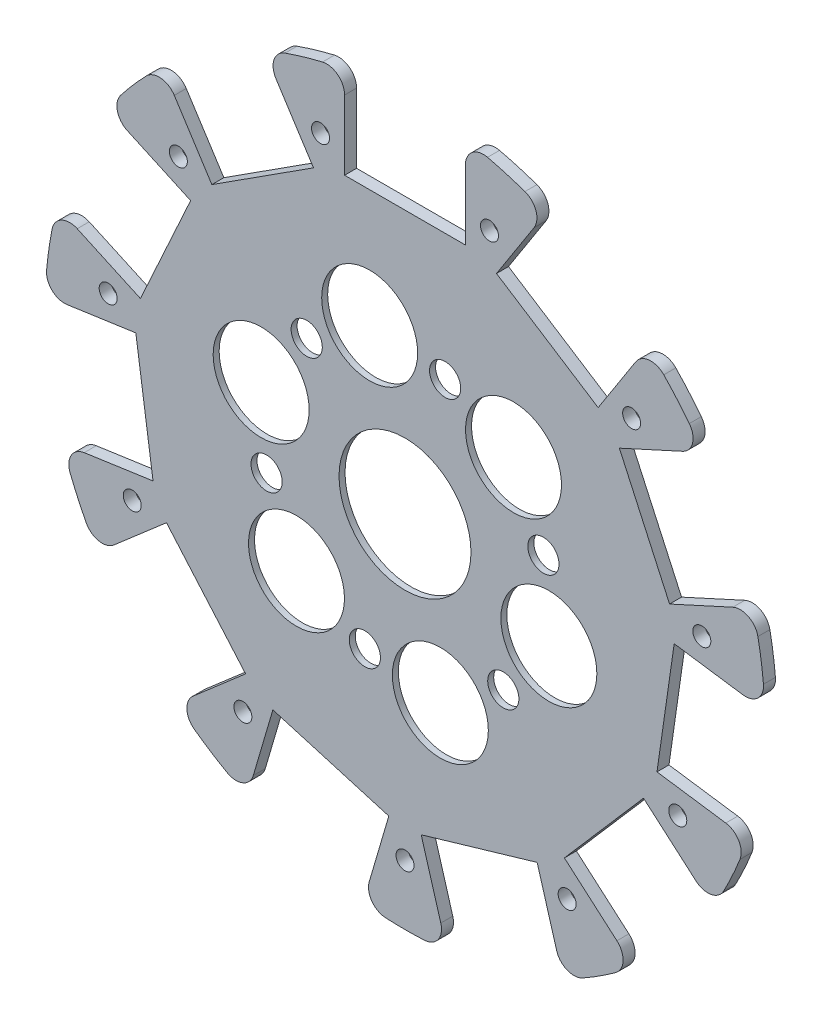
from build123d import *

# Parameters (mm, degrees)
BOSS_EXTRUDE1_DEPTH = 2
SKETCH4_R           = 1.5
CUT_EXTRUDE3_DEPTH  = 2
SKETCH6_R           = 35
CUT_EXTRUDE4_DEPTH  = 1
SKETCH7_R           = 11
SKETCH7_R_2         = 2.6
SKETCH7_R_3         = 8
CUT_EXTRUDE5_DEPTH  = 10


with BuildPart() as part:
    # Sketch1 → Boss-Extrude1 (new body)
    with BuildSketch(Plane.XY):
        with BuildLine():
            Line((21.520746486, 52.119258472), (15.256667967, 42.372162038))
            Line((15.256667967, 42.372162038), (32.20522538, 31.479985569))
            Line((32.20522538, 31.479985569), (38.4693039, 41.227082003))
            ThreePointArc((38.4693039, 41.227082003), (40.698070229, 42.590620718), (43.150594208, 41.689641633))
            ThreePointArc((43.150594208, 41.689641633), (45.344974461, 39.291644037), (47.406271028, 36.778328771))
            ThreePointArc((47.406271028, 36.778328771), (47.949048893, 34.222545257), (46.282202516, 32.210516346))
            Line((46.282202516, 32.210516346), (35.742846148, 27.397353567))
            Line((35.742846148, 27.397353567), (44.112124759, 9.071189697))
            Line((44.112124759, 9.071189697), (54.651481127, 13.884352476))
            ThreePointArc((54.651481127, 13.884352476), (57.263623361, 13.826472187), (58.839711753, 11.742585779))
            ThreePointArc((58.839711753, 11.742585779), (59.389286513, 8.538890296), (59.764558712, 5.310133889))
            ThreePointArc((59.764558712, 5.310133889), (58.83941162, 2.86662411), (56.349386262, 2.075162869))
            Line((56.349386262, 2.075162869), (44.880923224, 3.724078919))
            Line((44.880923224, 3.724078919), (42.013736207, -16.217644809))
            Line((42.013736207, -16.217644809), (53.482199245, -17.86656086))
            ThreePointArc((53.482199245, -17.86656086), (55.648380681, -19.32748357), (55.847636558, -21.93265809))
            ThreePointArc((55.847636558, -21.93265809), (54.577919721, -24.92490078), (53.148021281, -27.843990983))
            ThreePointArc((53.148021281, -27.843990983), (51.048676897, -29.399429937), (48.526038015, -28.719040157))
            Line((48.526038015, -28.719040157), (39.76962429, -21.131564473))
            Line((39.76962429, -21.131564473), (26.576283265, -36.357491677))
            Line((26.576283265, -36.357491677), (35.33269699, -43.944967362))
            ThreePointArc((35.33269699, -43.944967362), (36.365170327, -46.345099856), (35.124331356, -48.644437984))
            ThreePointArc((35.124331356, -48.644437984), (32.438449047, -50.47521197), (29.657362619, -52.157845455))
            ThreePointArc((29.657362619, -52.157845455), (27.050347952, -52.331372705), (25.296015568, -50.395150852))
            Line((25.296015568, -50.395150852), (22.031750643, -39.278085453))
            Line((22.031750643, -39.278085453), (2.701048165, -44.954091828))
            Line((2.701048165, -44.954091828), (5.96531309, -56.071157227))
            ThreePointArc((5.96531309, -56.071157227), (5.536275339, -58.648474396), (3.249299125, -59.911952524))
            ThreePointArc((3.249299125, -59.911952524), (0, -60), (-3.249299125, -59.911952524))
            ThreePointArc((-3.249299125, -59.911952524), (-5.536275339, -58.648474396), (-5.96531309, -56.071157227))
            Line((-5.96531309, -56.071157227), (-2.701048165, -44.954091828))
            Line((-2.701048165, -44.954091828), (-22.031750643, -39.278085453))
            Line((-22.031750643, -39.278085453), (-25.296015568, -50.395150852))
            ThreePointArc((-25.296015568, -50.395150852), (-27.050347952, -52.331372705), (-29.657362619, -52.157845455))
            ThreePointArc((-29.657362619, -52.157845455), (-32.438449047, -50.47521197), (-35.124331356, -48.644437984))
            ThreePointArc((-35.124331356, -48.644437984), (-36.365170327, -46.345099856), (-35.33269699, -43.944967362))
            Line((-35.33269699, -43.944967362), (-26.576283265, -36.357491677))
            Line((-26.576283265, -36.357491677), (-39.76962429, -21.131564473))
            Line((-39.76962429, -21.131564473), (-48.526038015, -28.719040157))
            ThreePointArc((-48.526038015, -28.719040157), (-51.048676897, -29.399429937), (-53.148021281, -27.843990983))
            ThreePointArc((-53.148021281, -27.843990983), (-54.577919721, -24.92490078), (-55.847636558, -21.93265809))
            ThreePointArc((-55.847636558, -21.93265809), (-55.648380681, -19.32748357), (-53.482199245, -17.86656086))
            Line((-53.482199245, -17.86656086), (-42.013736207, -16.217644809))
            Line((-42.013736207, -16.217644809), (-44.880923224, 3.724078919))
            Line((-44.880923224, 3.724078919), (-56.349386262, 2.075162869))
            ThreePointArc((-56.349386262, 2.075162869), (-58.83941162, 2.86662411), (-59.764558712, 5.310133889))
            ThreePointArc((-59.764558712, 5.310133889), (-59.389286513, 8.538890296), (-58.839711753, 11.742585779))
            ThreePointArc((-58.839711753, 11.742585779), (-57.263623361, 13.826472187), (-54.651481127, 13.884352476))
            Line((-54.651481127, 13.884352476), (-44.112124759, 9.071189697))
            Line((-44.112124759, 9.071189697), (-35.742846148, 27.397353567))
            Line((-35.742846148, 27.397353567), (-46.282202516, 32.210516346))
            ThreePointArc((-46.282202516, 32.210516346), (-47.949048893, 34.222545257), (-47.406271028, 36.778328771))
            ThreePointArc((-47.406271028, 36.778328771), (-45.344974461, 39.291644037), (-43.150594208, 41.689641633))
            ThreePointArc((-43.150594208, 41.689641633), (-40.698070229, 42.590620718), (-38.4693039, 41.227082003))
            Line((-38.4693039, 41.227082003), (-32.20522538, 31.479985569))
            Line((-32.20522538, 31.479985569), (-15.256667967, 42.372162038))
            Line((-15.256667967, 42.372162038), (-21.520746486, 52.119258472))
            ThreePointArc((-21.520746486, 52.119258472), (-21.835201934, 54.713050089), (-19.99682725, 56.569664131))
            ThreePointArc((-19.99682725, 56.569664131), (-16.90395341, 57.569578417), (-13.76146789, 58.400530832))
            ThreePointArc((-13.76146789, 58.400530832), (-11.211167359, 57.832548102), (-10.073394495, 55.480504291))
            Line((-10.073394495, 55.480504291), (-10.073394495, 43.894108449))
            Line((-10.073394495, 43.894108449), (10.073394495, 43.894108449))
            Line((10.073394495, 43.894108449), (10.073394495, 55.480504291))
            ThreePointArc((10.073394495, 55.480504291), (11.211167359, 57.832548102), (13.76146789, 58.400530832))
            ThreePointArc((13.76146789, 58.400530832), (16.90395341, 57.569578417), (19.99682725, 56.569664131))
            ThreePointArc((19.99682725, 56.569664131), (21.835201934, 54.713050089), (21.520746486, 52.119258472))
        make_face()
    extrude(amount=BOSS_EXTRUDE1_DEPTH)

    # Sketch4 → Cut-Extrude3 (cut)
    with BuildSketch(Plane.XY.offset(2)):
        with Locations((-14.086627842, 47.974648681)):
            Circle(SKETCH4_R)
        with Locations((14.086627842, 47.974648681)):
            Circle(SKETCH4_R)
        with Locations((37.787478718, 32.743036697)):
            Circle(SKETCH4_R)
        with Locations((49.491072094, 7.115741914)):
            Circle(SKETCH4_R)
        with Locations((45.481599768, -20.77075065)):
            Circle(SKETCH4_R)
        with Locations((27.032040873, -42.062676642)):
            Circle(SKETCH4_R)
        with Locations((0, -50)):
            Circle(SKETCH4_R)
        with Locations((-27.032040873, -42.062676642)):
            Circle(SKETCH4_R)
        with Locations((-45.481599768, -20.77075065)):
            Circle(SKETCH4_R)
        with Locations((-49.491072094, 7.115741914)):
            Circle(SKETCH4_R)
        with Locations((-37.787478718, 32.743036697)):
            Circle(SKETCH4_R)
    extrude(amount=-CUT_EXTRUDE3_DEPTH, mode=Mode.SUBTRACT)

    # Sketch6 → Cut-Extrude4 (cut)
    with BuildSketch(Plane(origin=(0, 0, 0), x_dir=(-1, 0, 0), z_dir=(0, 0, -1))):
        Circle(SKETCH6_R)
    extrude(amount=-CUT_EXTRUDE4_DEPTH, mode=Mode.SUBTRACT)

    # Sketch7 → Cut-Extrude5 (cut)
    with BuildSketch(Plane(origin=(0, 0, 1), x_dir=(-1, 0, 0), z_dir=(0, 0, -1))):
        Circle(SKETCH7_R)
        with Locations((-6.691148225, 22.787958123)):
            Circle(SKETCH7_R_2)
        with Locations((-18.093350953, 17.251975287)):
            Circle(SKETCH7_R_3)
        with Locations((5.893973388, 24.295289208)):
            Circle(SKETCH7_R_3)
        with Locations((16.389376523, 17.188683405)):
            Circle(SKETCH7_R_2)
        with Locations((23.98732434, 7.043313921)):
            Circle(SKETCH7_R_3)
        with Locations((23.080524748, -5.599274718)):
            Circle(SKETCH7_R_2)
        with Locations((18.093350953, -17.251975287)):
            Circle(SKETCH7_R_3)
        with Locations((6.691148225, -22.787958123)):
            Circle(SKETCH7_R_2)
        with Locations((-5.893973388, -24.295289208)):
            Circle(SKETCH7_R_3)
        with Locations((-16.389376523, -17.188683405)):
            Circle(SKETCH7_R_2)
        with Locations((-23.98732434, -7.043313921)):
            Circle(SKETCH7_R_3)
        with Locations((-23.080524748, 5.599274718)):
            Circle(SKETCH7_R_2)
    extrude(amount=-CUT_EXTRUDE5_DEPTH, mode=Mode.SUBTRACT)


solid = part.part
